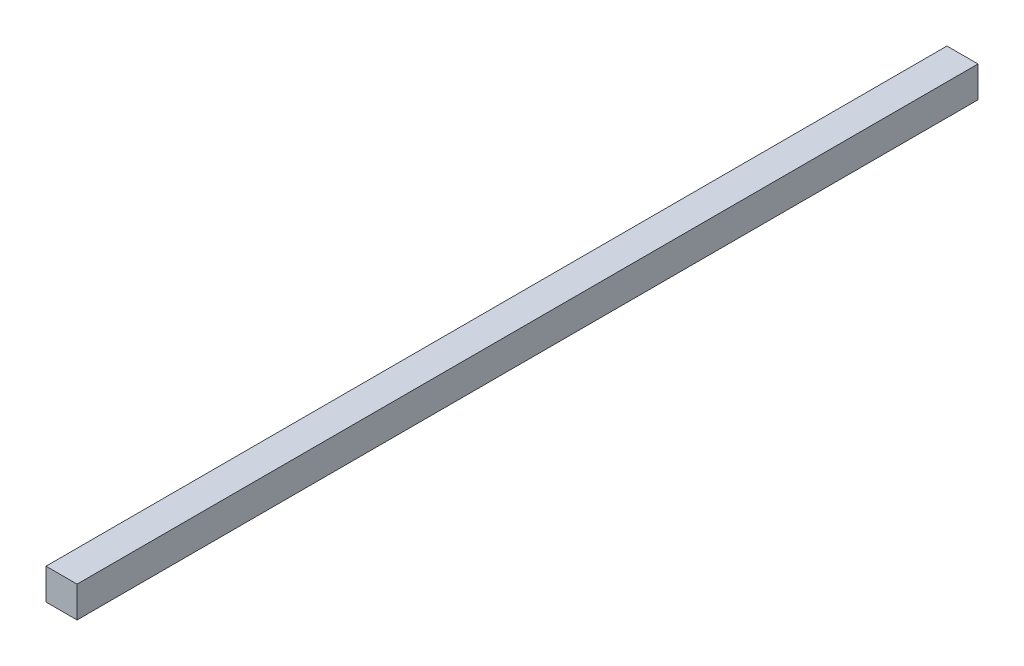
from build123d import *

# Parameters (mm, degrees)
SKETCH_1_W          = 20
SKETCH_1_H          = 20
EXTRUDE_1_DEPTH     = 580
SKETCH_2_R          = 7.5
CUT_EXTRUDE_1_DEPTH = 15


with BuildPart() as part:
    # Эскиз1 → Бобышка-Вытянуть1 (new body)
    with BuildSketch(Plane.XY):
        Rectangle(SKETCH_1_W, SKETCH_1_H)
    extrude(amount=EXTRUDE_1_DEPTH)

    # Эскиз2 → Вырез-Вытянуть1 (cut)
    with BuildSketch(Plane(origin=(0, 0, 0), x_dir=(-1, 0, 0), z_dir=(0, 0, -1))):
        Circle(SKETCH_2_R)
    extrude(amount=-CUT_EXTRUDE_1_DEPTH, mode=Mode.SUBTRACT)


solid = part.part
